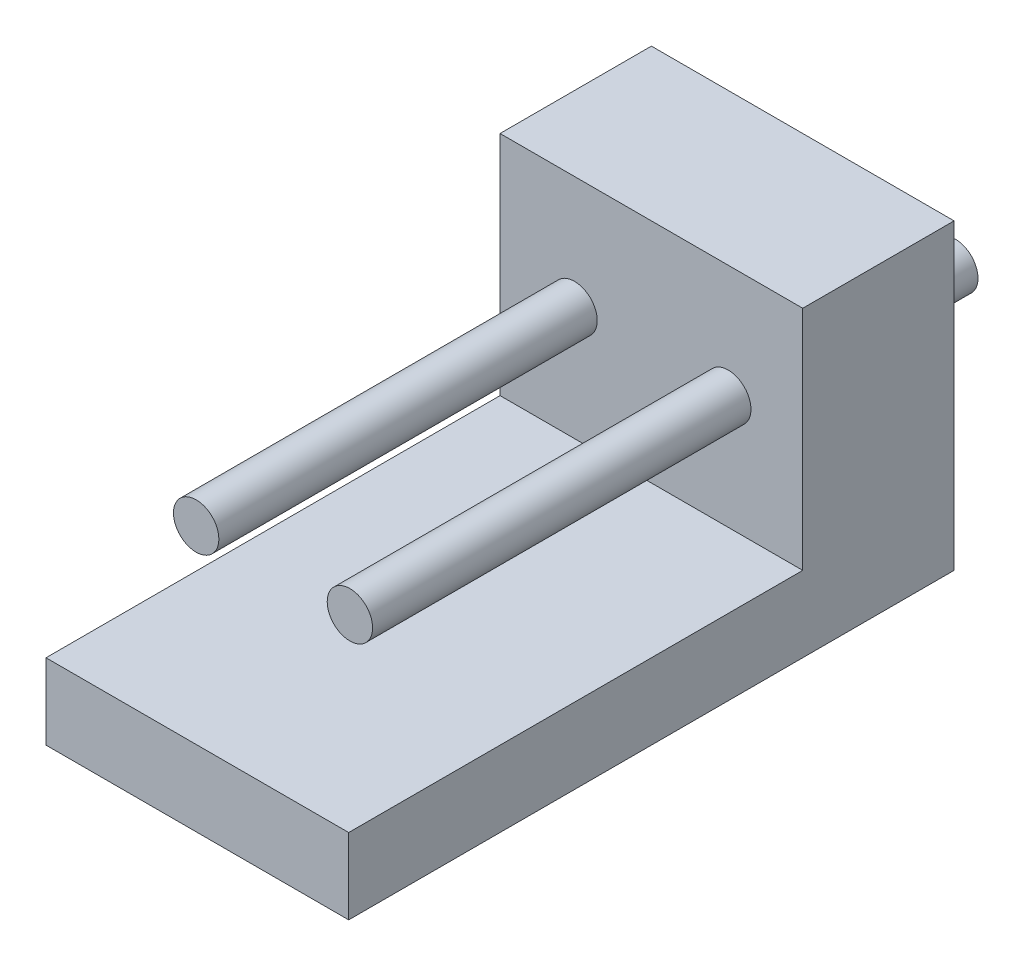
from build123d import *

# Parameters (mm, degrees)
SKETCH_1_W           = 10
SKETCH_1_H           = 10
EXTRUDE_1_DEPTH      = 5
SKETCH_2_W           = 10
SKETCH_2_H           = 2.5
EXTRUDE_2_DEPTH      = 15
EXTRUDE_3_DEPTH      = 12.5
EXTRUDE_3_DEPTH_BACK = 7.5
SKETCH_3_R           = 0.75


with BuildPart() as part:
    # Эскиз1 → Вытянуть1 (new body)
    with BuildSketch(Plane.XY):
        with Locations((5, 5)):
            Rectangle(SKETCH_1_W, SKETCH_1_H)
    extrude(amount=EXTRUDE_1_DEPTH)

    # Эскиз2 → Вытянуть2 (add)
    with BuildSketch(Plane.XY.offset(5)):
        with Locations((5, 1.25)):
            Rectangle(SKETCH_2_W, SKETCH_2_H)
    extrude(amount=EXTRUDE_2_DEPTH)

    # Эскиз3 → Вытянуть3 (add, two sides: drawn at the far end of the back side and taken through both)
    with BuildSketch(Plane.XY.offset(5).offset(-EXTRUDE_3_DEPTH_BACK)):
        with Locations((7.54, 6.25)):
            Circle(SKETCH_3_R)
        with Locations((2.46, 6.25)):
            Circle(SKETCH_3_R)
    extrude(amount=EXTRUDE_3_DEPTH + EXTRUDE_3_DEPTH_BACK)


solid = part.part
